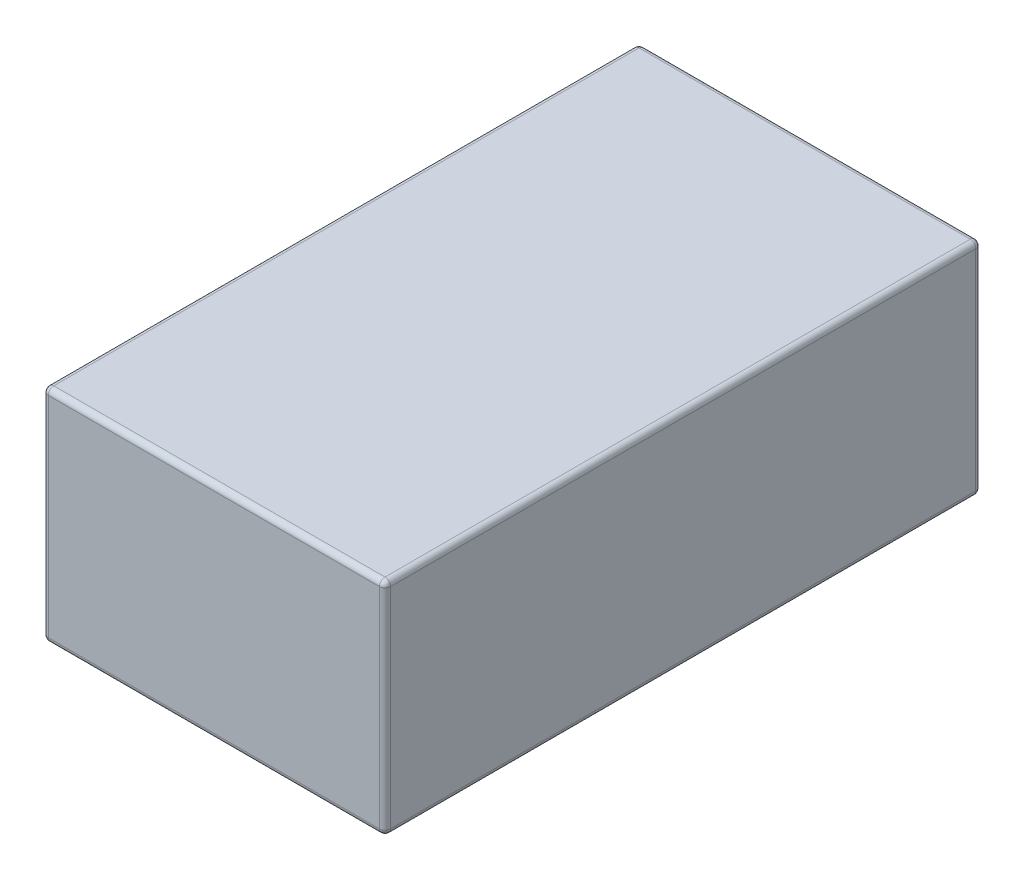
from build123d import *

# Parameters (mm, degrees)
SKETCH_1_W          = 62
SKETCH_1_H          = 108
EXTRUDE_1_DEPTH     = 40
CUT_EXTRUDE_1_DEPTH = 10
FILLET_1_R          = 1


with BuildPart() as part:
    # 草图1 → 凸台-拉伸1 (new body)
    with BuildSketch(Plane(origin=(0, 0, 0), x_dir=(1, 0, 0), z_dir=(0, 1, 0))):
        Rectangle(SKETCH_1_W, SKETCH_1_H)
    extrude(amount=EXTRUDE_1_DEPTH)

    # 草图3 → 切除-拉伸1 (cut)
    # profile 1 of 2: a face of its own
    with BuildSketch(Plane.XZ):
        with BuildLine():
            add(Edge.make_bspline(
                [(2.692365591, 2.665268817), (2.708060657, 2.670496709), (2.744029659, 2.682477677), (2.80834551, 2.690523883), (2.887927636, 2.696251716), (2.983732873, 2.699159867), (3.095176708, 2.692209812), (3.221060717, 2.672013075), (3.360909996, 2.637915008), (3.484604281, 2.600564752), (3.586255639, 2.564755463), (3.659608389, 2.534859596), (3.727296465, 2.501561507), (3.790218923, 2.46639212), (3.847417453, 2.427878502), (3.899532297, 2.387193224), (3.946790581, 2.344282462), (3.999830389, 2.28439533), (4.055731903, 2.210533055), (4.105881323, 2.121784614), (4.137914317, 2.035656741), (4.142240117, 1.978296237), (4.144301075, 1.950967742)],
                knots=[0, 0, 0, 0, 0.553780623, 1.269120991, 2.163729509, 3.232830331, 4.480664985, 5.903029542, 7.503376039, 9.305785439, 10.234765888, 11.117780202, 11.960870582, 12.763595554, 13.533856831, 14.271233816, 14.980009463, 15.671230546, 16.952115016, 18.078508404, 19.084536065, 20, 20, 20, 20], degree=3))
            add(Edge.make_bspline(
                [(4.144301075, 1.950967742), (4.143389416, 1.935084224), (4.141652603, 1.904824359), (4.12963635, 1.861718693), (4.10761855, 1.824815956), (4.08685466, 1.805997545), (4.07655914, 1.796666667)],
                knots=[0, 0, 0, 0, 1.092064677, 2.080504456, 3.048241631, 4, 4, 4, 4], degree=3))
            add(Edge.make_bspline(
                [(4.07655914, 1.796666667), (4.047162709, 1.774192086), (3.990212739, 1.730651881), (3.91184315, 1.661187835), (3.840230968, 1.593644688), (3.785417093, 1.533698618), (3.739407496, 1.479608917), (3.696941707, 1.425849142), (3.644116984, 1.359921622), (3.58236311, 1.280462712), (3.510994627, 1.188220192), (3.430571804, 1.082562813), (3.340146004, 0.964660887), (3.27715558, 0.881434986), (3.244086022, 0.837741935)],
                knots=[0, 0, 0, 0, 1.044716322, 2.023938297, 2.956112171, 3.82364298, 4.316308196, 4.961480688, 5.758265085, 6.70229449, 7.803562713, 9.052159997, 10.452403401, 12, 12, 12, 12], degree=3))
            add(Edge.make_bspline(
                [(3.244086022, 0.837741935), (3.260120237, 0.811028691), (3.288976935, 0.762952997), (3.324565831, 0.697014928), (3.34629993, 0.644095424), (3.354687882, 0.603251711), (3.35203643, 0.572129114), (3.33792162, 0.550280319), (3.315186758, 0.537149104), (3.272687733, 0.53458), (3.208488072, 0.54077049), (3.136376098, 0.554589903), (3.067070901, 0.568263093), (3.002334996, 0.574332256), (2.927498906, 0.577726314), (2.843391635, 0.579679511), (2.751490601, 0.57637421), (2.653899933, 0.563791507), (2.551594536, 0.543455101), (2.482510206, 0.524556016), (2.446989247, 0.51483871)],
                knots=[0, 0, 0, 0, 1.380750272, 2.484929504, 3.319218933, 3.906050837, 4.321227089, 4.666660844, 5.015655865, 5.441854461, 6.523290334, 7.877957796, 8.691536812, 9.653071169, 10.755345, 12.012091177, 13.380969223, 14.826428693, 16.36825088, 18, 18, 18, 18], degree=3))
            add(Edge.make_bspline(
                [(2.446989247, 0.51483871), (2.444043437, 0.485760475), (2.438692827, 0.432944341), (2.437665864, 0.379873763), (2.437204301, 0.356021505)],
                knots=[0, 0, 0, 0, 1.101111799, 2, 2, 2, 2], degree=3))
            add(Edge.make_bspline(
                [(2.437204301, 0.356021505), (2.437889015, 0.329295298), (2.439145893, 0.280235958), (2.455920883, 0.213999686), (2.481514059, 0.160524327), (2.522756653, 0.122080276), (2.577960778, 0.098481742), (2.646825869, 0.08179906), (2.731988204, 0.071926793), (2.794203781, 0.070676272), (2.827849462, 0.07)],
                knots=[0, 0, 0, 0, 1.125302992, 2.065636258, 2.866371255, 3.593285261, 4.38938235, 5.373391023, 6.579551108, 8, 8, 8, 8], degree=3))
            Line((2.827849462, 0.07), (3.395376344, 0.096344086))
            add(Edge.make_bspline(
                [(3.395376344, 0.096344086), (3.421740695, 0.096260922), (3.471538315, 0.096103839), (3.541585967, 0.089551776), (3.603001383, 0.081474109), (3.657055169, 0.067372752), (3.707450666, 0.047903401), (3.754618428, 0.016227211), (3.80149082, -0.024645373), (3.844427581, -0.073906018), (3.882115161, -0.12243821), (3.912023884, -0.164260274), (3.928791691, -0.198022565), (3.93758457, -0.224522354), (3.933647523, -0.245511006), (3.924955225, -0.263377625), (3.909335457, -0.27821385), (3.891569805, -0.288400888), (3.872402266, -0.296032417), (3.85106364, -0.301574249), (3.823850123, -0.30870053), (3.789809762, -0.315032378), (3.749427734, -0.322596246), (3.702740414, -0.330774877), (3.64988142, -0.34006336), (3.52928797, -0.358038344), (3.341651566, -0.380645456), (3.17291798, -0.383796), (3.08827957, -0.385376344)],
                knots=[0, 0, 0, 0, 1.306910492, 2.468523945, 3.487530944, 4.374938771, 5.234601293, 6.152800332, 7.175978169, 8.312796182, 9.385697657, 10.2278885, 10.851232964, 11.261713174, 11.576782984, 11.88287744, 12.234861316, 12.625428626, 12.89349156, 13.255881141, 13.717671377, 14.288764538, 14.972193603, 15.755802524, 16.639625557, 17.634018942, 21.803542446, 26, 26, 26, 26], degree=3))
            add(Edge.make_bspline(
                [(3.08827957, -0.385376344), (3.045856435, -0.384868874), (2.963668343, -0.383885732), (2.844638069, -0.374343223), (2.733802347, -0.361056904), (2.631644002, -0.339336671), (2.537452217, -0.313798403), (2.452132205, -0.281260854), (2.374816352, -0.243644985), (2.306170801, -0.198960423), (2.244546434, -0.148526158), (2.188794415, -0.093423142), (2.138148496, -0.03373808), (2.092708231, 0.030669398), (2.052477267, 0.100027652), (2.019246125, 0.175103239), (1.989090689, 0.253951991), (1.974782785, 0.309191127), (1.967526882, 0.337204301)],
                knots=[0, 0, 0, 0, 1.391550044, 2.69590734, 3.916035752, 5.050968551, 6.119507765, 7.114763045, 8.042467133, 8.935219683, 9.795306254, 10.650969539, 11.503657974, 12.360112807, 13.234110458, 14.129288559, 15.051314528, 16, 16, 16, 16], degree=3))
            add(Edge.make_bspline(
                [(1.967526882, 0.337204301), (1.934807297, 0.326641942), (1.87195378, 0.306351911), (1.779213866, 0.285555784), (1.692712499, 0.272024333), (1.613042784, 0.267756331), (1.542027144, 0.269513825), (1.481305499, 0.277477993), (1.431938911, 0.290314049), (1.394016072, 0.304731212), (1.369042192, 0.331435561), (1.347260589, 0.365211794), (1.321184218, 0.41371286), (1.291444897, 0.477287294), (1.257108951, 0.555460535), (1.217598077, 0.648303883), (1.175136059, 0.756641286), (1.129652024, 0.876712601), (1.084493811, 1.002100189), (1.04436014, 1.126751338), (1.01165452, 1.247509779), (0.983039362, 1.363228234), (0.962370354, 1.475173419), (0.946003552, 1.582517561), (0.936731702, 1.686106652), (0.935461123, 1.753747009), (0.93483871, 1.78688172)],
                knots=[0, 0, 0, 0, 1.149240449, 2.207662655, 3.174745525, 4.073929196, 4.871414988, 5.5489629, 6.112683219, 6.585607399, 6.870387179, 7.317210698, 7.929250324, 8.70987367, 9.664021703, 10.784478502, 12.083908154, 13.554983249, 15.078298145, 16.540372819, 17.932674469, 19.261567318, 20.525375079, 21.7380716, 22.89195818, 24, 24, 24, 24], degree=3))
            add(Edge.make_bspline(
                [(0.93483871, 1.78688172), (0.934414756, 1.82277142), (0.93363137, 1.889088934), (0.927879317, 1.980827705), (0.918358575, 2.057070293), (0.902869521, 2.11812405), (0.886497568, 2.165967426), (0.875778101, 2.204059784), (0.869957108, 2.232975151), (0.865554068, 2.255930876), (0.87144981, 2.280833964), (0.898524847, 2.28541553), (0.927131211, 2.278066979), (0.966120293, 2.261799018), (1.021242812, 2.237886256), (1.089916852, 2.204285487), (1.167370303, 2.160861753), (1.244852385, 2.102034809), (1.321115308, 2.030805075), (1.368598895, 1.976746595), (1.393225806, 1.948709677)],
                knots=[0, 0, 0, 0, 1.714520076, 3.16811535, 4.390379319, 5.37885376, 6.171176299, 6.805129531, 7.270620928, 7.572446211, 7.940156515, 8.327097602, 8.705591225, 9.373430328, 10.328863719, 11.583326282, 13.022566792, 14.564098569, 16.21800236, 18, 18, 18, 18], degree=3))
            add(Edge.make_bspline(
                [(1.393225806, 1.948709677), (1.417211867, 1.988741901), (1.462359029, 2.064091553), (1.535005279, 2.1644402), (1.604124438, 2.247361159), (1.664116049, 2.303602774), (1.71491893, 2.340771747), (1.758022046, 2.367740476), (1.807220583, 2.394973828), (1.862906899, 2.421727095), (1.92483926, 2.449038162), (1.993422704, 2.475601988), (2.067611351, 2.503917787), (2.119742067, 2.520975129), (2.146666667, 2.529784946)],
                knots=[0, 0, 0, 0, 1.707717922, 3.214309404, 4.530362721, 5.654877944, 6.213352942, 6.832574337, 7.515051122, 8.270904371, 9.093461732, 9.992325248, 10.963071218, 12, 12, 12, 12], degree=3))
            add(Edge.make_bspline(
                [(2.146666667, 2.529784946), (2.149857675, 2.557364963), (2.156518971, 2.614938826), (2.163285494, 2.705818283), (2.166565563, 2.804989804), (2.168130795, 2.891575592), (2.167321542, 2.960093161), (2.165326617, 3.005565244), (2.16127213, 3.043941726), (2.157600041, 3.075557944), (2.150919272, 3.100316695), (2.142826786, 3.117626976), (2.133779389, 3.130745724), (2.1250877, 3.132589637), (2.121075269, 3.13344086)],
                knots=[0, 0, 0, 0, 1.613720619, 3.368675535, 5.295099884, 7.380767975, 8.401728707, 9.277841715, 10.025174524, 10.64390704, 11.128690536, 11.500502505, 11.769412006, 12, 12, 12, 12], degree=3))
            add(Edge.make_bspline(
                [(2.121075269, 3.13344086), (2.116790923, 3.132350439), (2.107140885, 3.129894381), (2.097229324, 3.114202715), (2.091468503, 3.09169738), (2.087217518, 3.063365386), (2.082802952, 3.034850712), (2.073772662, 3.010996176), (2.057178156, 2.996170817), (2.044031857, 2.994344532), (2.037526882, 2.99344086)],
                knots=[0, 0, 0, 0, 0.579354927, 1.30493612, 2.334418076, 3.744603853, 5.160889958, 6.238381738, 7.128326168, 8, 8, 8, 8], degree=3))
            add(Edge.make_bspline(
                [(2.037526882, 2.99344086), (2.031022616, 2.994114356), (2.017221789, 2.995543387), (1.999683488, 3.010791421), (1.98292903, 3.031050869), (1.969100929, 3.06061771), (1.954662382, 3.096781894), (1.943357952, 3.141985494), (1.931761075, 3.194599123), (1.92612693, 3.232747129), (1.92311828, 3.25311828)],
                knots=[0, 0, 0, 0, 0.512685013, 1.087821071, 1.788185926, 2.624591649, 3.681423227, 4.910716466, 6.350313288, 8, 8, 8, 8], degree=3))
            add(Edge.make_bspline(
                [(1.92311828, 3.25311828), (1.913786574, 3.275836732), (1.896433654, 3.31808319), (1.876642166, 3.378402646), (1.863980288, 3.4302088), (1.859002413, 3.474645721), (1.86402431, 3.51389476), (1.884155358, 3.546832876), (1.915633064, 3.573889683), (1.972423658, 3.598187155), (2.046267747, 3.622040083), (2.107830981, 3.626060036), (2.13688172, 3.627956989)],
                knots=[0, 0, 0, 0, 1.275020111, 2.370983895, 3.293819499, 4.039309166, 4.686169846, 5.305137666, 5.997624495, 6.807609614, 8.493560299, 10, 10, 10, 10], degree=3))
            add(Edge.make_bspline(
                [(2.13688172, 3.627956989), (2.162403093, 3.626877652), (2.211407252, 3.624805192), (2.280602636, 3.60256147), (2.341674795, 3.567030212), (2.41014842, 3.495928218), (2.490086261, 3.38990634), (2.578263269, 3.280023622), (2.641400307, 3.174163702), (2.674941064, 3.077387045), (2.69405108, 2.966853988), (2.696397455, 2.888647812), (2.697634409, 2.847419355)],
                knots=[0, 0, 0, 0, 0.731505247, 1.404579586, 2.067722297, 2.741144488, 4.223818725, 5.888825166, 6.787197857, 7.75239781, 8.815116991, 10, 10, 10, 10], degree=3))
            add(Edge.make_bspline(
                [(2.697634409, 2.847419355), (2.697250987, 2.820068374), (2.696399468, 2.759326223), (2.693796497, 2.698633058), (2.692365591, 2.665268817)],
                knots=[0, 0, 0, 0, 0.900560175, 2, 2, 2, 2], degree=3))
        make_face()
        with BuildLine():
            add(Edge.make_bspline(
                [(2.852688172, 1.048494624), (2.879674384, 1.088796786), (2.931907457, 1.166803502), (3.005510645, 1.281651686), (3.07403453, 1.389266955), (3.137285768, 1.489557279), (3.194005194, 1.583549887), (3.244948981, 1.670363779), (3.290363717, 1.750271788), (3.329843777, 1.823521677), (3.363350421, 1.890954102), (3.39422299, 1.951586438), (3.418626649, 2.007737403), (3.440325228, 2.057751089), (3.455938326, 2.102913662), (3.467598901, 2.142271648), (3.474793774, 2.176001491), (3.477551884, 2.212118759), (3.475885767, 2.249167127), (3.471628657, 2.285975481), (3.465777989, 2.314042991), (3.454925699, 2.335180435), (3.434991068, 2.347348135), (3.408460223, 2.355004018), (3.372968167, 2.36002817), (3.346218273, 2.360286811), (3.331397849, 2.360430108)],
                knots=[0, 0, 0, 0, 2.207533216, 4.272783509, 6.208374139, 8.01438313, 9.669259998, 11.204742639, 12.595668911, 13.852484494, 14.991343408, 16.022957787, 16.948216244, 17.777445438, 18.503367713, 19.121391775, 19.645444377, 20.069351102, 20.766312679, 21.330045685, 21.75379857, 22.071087082, 22.37515375, 22.783229838, 23.325864668, 24, 24, 24, 24], degree=3))
            add(Edge.make_bspline(
                [(3.331397849, 2.360430108), (3.265381535, 2.359390004), (3.138955101, 2.357398124), (2.957194015, 2.343167959), (2.791597592, 2.319760751), (2.68817938, 2.293774321), (2.638924731, 2.281397849)],
                knots=[0, 0, 0, 0, 1.133283853, 2.170327684, 3.128588029, 4, 4, 4, 4], degree=3))
            add(Edge.make_bspline(
                [(2.638924731, 2.281397849), (2.635192556, 2.26387348), (2.626972393, 2.225275839), (2.618702284, 2.160818579), (2.610120093, 2.084831945), (2.606331583, 2.030021579), (2.604301075, 2.000645161)],
                knots=[0, 0, 0, 0, 0.759081118, 1.671885585, 2.752213022, 4, 4, 4, 4], degree=3))
            add(Edge.make_bspline(
                [(2.604301075, 2.000645161), (2.619548294, 2.003907696), (2.649818849, 2.010384861), (2.680768607, 2.010918132), (2.696129032, 2.011182796)],
                knots=[0, 0, 0, 0, 1.007396073, 2, 2, 2, 2], degree=3))
            add(Edge.make_bspline(
                [(2.696129032, 2.011182796), (2.709937361, 2.01043611), (2.737251006, 2.008959125), (2.777334741, 2.002340504), (2.813903512, 1.986667684), (2.849210135, 1.968614), (2.880475335, 1.942535738), (2.911708709, 1.913748237), (2.937114143, 1.876556305), (2.968705556, 1.824968588), (2.999623962, 1.763683596), (3.02989955, 1.701581038), (3.047502333, 1.65613672), (3.057411572, 1.623907641), (3.051706572, 1.60008017), (3.038388423, 1.581216176), (3.015442134, 1.566929035), (2.974915278, 1.550897387), (2.918942768, 1.528068979), (2.864882139, 1.492146089), (2.818956791, 1.454214498), (2.777838996, 1.413605696), (2.72890465, 1.362398748), (2.694497018, 1.32384565), (2.675806452, 1.302903226)],
                knots=[0, 0, 0, 0, 0.847625029, 1.676649638, 2.470144591, 3.274874384, 4.095880605, 4.954582549, 5.867688959, 6.840429065, 8.662367611, 10.071960045, 11.059644011, 11.671585918, 12.081729159, 12.512385048, 13.053863842, 13.707799244, 15.187310502, 16.743482136, 17.660590303, 18.834619167, 20.280533823, 22, 22, 22, 22], degree=3))
            add(Edge.make_bspline(
                [(2.675806452, 1.302903226), (2.679549631, 1.279669704), (2.68719227, 1.232232656), (2.724399508, 1.165327369), (2.77959749, 1.102164883), (2.827285214, 1.067147936), (2.852688172, 1.048494624)],
                knots=[0, 0, 0, 0, 0.876164182, 1.78890846, 2.82216513, 4, 4, 4, 4], degree=3))
        make_face(mode=Mode.SUBTRACT)
        with BuildLine():
            add(Edge.make_bspline(
                [(2.084193548, 2.12483871), (2.037002093, 2.107205131), (1.94733077, 2.073698506), (1.824097838, 2.015578661), (1.720193748, 1.95231814), (1.634499052, 1.885958035), (1.566435147, 1.816070068), (1.518800556, 1.740676616), (1.487592836, 1.66153611), (1.484389262, 1.60651106), (1.482795699, 1.579139785)],
                knots=[0, 0, 0, 0, 1.400088342, 2.660392117, 3.78120692, 4.774627862, 5.667610289, 6.476412897, 7.242117524, 8, 8, 8, 8], degree=3))
            add(Edge.make_bspline(
                [(1.482795699, 1.579139785), (1.483144794, 1.568339592), (1.483877197, 1.545680744), (1.486625942, 1.523175903), (1.488064516, 1.511397849)],
                knots=[0, 0, 0, 0, 0.953287084, 2, 2, 2, 2], degree=3))
            add(Edge.make_bspline(
                [(1.488064516, 1.511397849), (1.501824174, 1.519496258), (1.531651122, 1.53705126), (1.580865855, 1.563892456), (1.637415629, 1.595032547), (1.702054644, 1.629365482), (1.774456114, 1.667954775), (1.854674472, 1.709992761), (1.942941014, 1.755014407), (2.004162489, 1.78637069), (2.036021505, 1.802688172)],
                knots=[0, 0, 0, 0, 0.617357482, 1.338251963, 2.16753477, 3.113769204, 4.168438846, 5.340137805, 6.615835481, 8, 8, 8, 8], degree=3))
            add(Edge.make_bspline(
                [(2.036021505, 1.802688172), (2.039264587, 1.826274848), (2.045373737, 1.870706203), (2.054215395, 1.932959083), (2.062804757, 1.986566835), (2.069350066, 2.03125923), (2.074877561, 2.067104033), (2.078438413, 2.094007043), (2.081183516, 2.112394091), (2.083406342, 2.121584099), (2.084193548, 2.12483871)],
                knots=[0, 0, 0, 0, 1.754009283, 3.304111501, 4.632114419, 5.753546401, 6.631864835, 7.30366706, 7.753396049, 8, 8, 8, 8], degree=3))
        make_face(mode=Mode.SUBTRACT)
        with BuildLine():
            add(Edge.make_bspline(
                [(1.561075269, 0.973225806), (1.587975147, 0.991967228), (1.638471509, 1.027148563), (1.708181043, 1.077389864), (1.767287491, 1.121143212), (1.815575129, 1.158607014), (1.853264704, 1.19012975), (1.880358915, 1.214697686), (1.898214712, 1.232755435), (1.902728174, 1.244586616), (1.904301075, 1.248709677)],
                knots=[0, 0, 0, 0, 1.777925732, 3.337516321, 4.660077953, 5.765139076, 6.653633231, 7.318125862, 7.762372939, 8, 8, 8, 8], degree=3))
            add(Edge.make_bspline(
                [(1.904301075, 1.248709677), (1.9016913, 1.253951664), (1.894552319, 1.268290998), (1.878411997, 1.271968161), (1.868172043, 1.274301075)],
                knots=[0, 0, 0, 0, 0.731133853, 2, 2, 2, 2], degree=3))
            add(Edge.make_bspline(
                [(1.868172043, 1.274301075), (1.838640915, 1.284907284), (1.7777091, 1.306791161), (1.68626287, 1.349516981), (1.590130382, 1.398434827), (1.526230699, 1.436734076), (1.493333333, 1.456451613)],
                knots=[0, 0, 0, 0, 0.901316192, 1.859692951, 2.898109345, 4, 4, 4, 4], degree=3))
            add(Edge.make_bspline(
                [(1.493333333, 1.456451613), (1.494260637, 1.417025375), (1.49613172, 1.337472373), (1.509695349, 1.217323972), (1.530311177, 1.095292148), (1.550735281, 1.014253003), (1.561075269, 0.973225806)],
                knots=[0, 0, 0, 0, 0.966864773, 1.950908814, 2.96261901, 4, 4, 4, 4], degree=3))
        make_face(mode=Mode.SUBTRACT)
        with BuildLine():
            add(Edge.make_bspline(
                [(2.715698925, 1.004086022), (2.707783939, 1.032499147), (2.693172093, 1.084952589), (2.660782388, 1.152927996), (2.620497363, 1.204211627), (2.586433006, 1.223732586), (2.570430108, 1.232903226)],
                knots=[0, 0, 0, 0, 1.262082697, 2.329929597, 3.21542721, 4, 4, 4, 4], degree=3))
            add(Edge.make_bspline(
                [(2.570430108, 1.232903226), (2.554697059, 1.216959944), (2.526220693, 1.188103063), (2.493344727, 1.144148077), (2.471689636, 1.105545355), (2.463293969, 1.062625158), (2.467410781, 1.018890178), (2.480937296, 0.990304381), (2.48688172, 0.977741935)],
                knots=[0, 0, 0, 0, 1.374911662, 2.488550525, 3.371505862, 4.064219064, 5.149292777, 6, 6, 6, 6], degree=3))
            add(Edge.make_bspline(
                [(2.48688172, 0.977741935), (2.526050956, 0.981501186), (2.602490202, 0.98883741), (2.678592972, 0.999088047), (2.715698925, 1.004086022)],
                knots=[0, 0, 0, 0, 1.024846197, 2, 2, 2, 2], degree=3))
        make_face(mode=Mode.SUBTRACT)
    # profile 2 of 2: a face of its own
    with BuildSketch(Plane.XZ):
        with BuildLine():
            add(Edge.make_bspline(
                [(9.599032258, 1.29311828), (9.592444893, 1.264781631), (9.579750957, 1.210176543), (9.562460521, 1.131132997), (9.547398399, 1.058671381), (9.534918603, 0.99248264), (9.526254866, 0.932653575), (9.51901223, 0.879023155), (9.51523576, 0.831773789), (9.514375167, 0.802370173), (9.513978495, 0.788817204)],
                knots=[0, 0, 0, 0, 1.362865652, 2.626259694, 3.790345544, 4.830061757, 5.780872956, 6.622059719, 7.364867891, 8, 8, 8, 8], degree=3))
            add(Edge.make_bspline(
                [(9.513978495, 0.788817204), (9.514255523, 0.773225098), (9.514791634, 0.743050885), (9.523257102, 0.700202197), (9.536518572, 0.661926709), (9.550511936, 0.631252949), (9.571830295, 0.610219299), (9.597361071, 0.595597607), (9.63271294, 0.582767268), (9.677115717, 0.56913837), (9.731251138, 0.556743777), (9.795088493, 0.544895863), (9.86827657, 0.532642532), (9.978746631, 0.519306688), (10.121914642, 0.504169446), (10.294141022, 0.491749593), (10.464021933, 0.482948252), (10.63099099, 0.480536933), (10.794615819, 0.485126513), (10.953026904, 0.500122172), (11.106288267, 0.52477659), (11.251153365, 0.559845204), (11.38300313, 0.600588077), (11.497912244, 0.64207904), (11.592400745, 0.685966662), (11.668933135, 0.732200822), (11.728952278, 0.783944801), (11.77767772, 0.839264675), (11.814584078, 0.901203132), (11.841481079, 0.969677437), (11.859703354, 1.048100326), (11.873887141, 1.138394999), (11.882232961, 1.242558043), (11.884990386, 1.316439695), (11.886451613, 1.355591398)],
                knots=[0, 0, 0, 0, 0.49319545, 0.954443461, 1.374051513, 1.77927045, 2.00400226, 2.310598557, 2.703075791, 3.193189541, 3.780993194, 4.460412132, 5.249377634, 6.130429517, 7.983615499, 9.808134717, 11.598000493, 13.370000485, 15.095064169, 16.779072611, 18.405333761, 20.006794307, 21.494656371, 22.77427168, 23.872529852, 24.789706873, 25.595496559, 26.372854254, 27.114128646, 27.866602768, 28.693313485, 29.658647138, 30.759259563, 32, 32, 32, 32], degree=3))
            add(Edge.make_bspline(
                [(11.886451613, 1.355591398), (11.886485147, 1.370955064), (11.886542535, 1.397247905), (11.891813067, 1.429811685), (11.895392746, 1.451866582), (11.911502194, 1.464226412), (11.929811327, 1.445104046), (11.945836782, 1.416241548), (11.970634495, 1.366168699), (11.986465293, 1.32651525), (11.995591398, 1.303655914)],
                knots=[0, 0, 0, 0, 1.25511351, 2.147957425, 2.713763759, 3.0560266, 3.529458808, 4.482111776, 5.972015316, 8, 8, 8, 8], degree=3))
            Line((11.995591398, 1.303655914), (12.161935484, 0.892688172))
            add(Edge.make_bspline(
                [(12.161935484, 0.892688172), (12.170038886, 0.872395057), (12.18559106, 0.833448197), (12.206753896, 0.777011072), (12.224477082, 0.725448996), (12.240206585, 0.679059099), (12.25156413, 0.637320779), (12.258716898, 0.599992265), (12.264889595, 0.567975498), (12.265520676, 0.547979597), (12.265806452, 0.538924731)],
                knots=[0, 0, 0, 0, 1.416118151, 2.717835919, 3.905709705, 4.949523432, 5.89218533, 6.705350077, 7.413735803, 8, 8, 8, 8], degree=3))
            add(Edge.make_bspline(
                [(12.265806452, 0.538924731), (12.264383322, 0.524764139), (12.261405812, 0.495136965), (12.233537415, 0.454907472), (12.193180059, 0.416682092), (12.136264211, 0.381518524), (12.065014289, 0.346854343), (11.97752113, 0.315057683), (11.874609525, 0.28469397), (11.714725408, 0.245411204), (11.497394018, 0.204093125), (11.222252012, 0.170764365), (10.9324361, 0.147630828), (10.734134345, 0.14557174), (10.632473118, 0.144516129)],
                knots=[0, 0, 0, 0, 0.289291107, 0.605262688, 0.978580504, 1.435037502, 1.976610234, 2.611976756, 3.352019369, 4.189186046, 6.006936304, 7.910751384, 9.903608926, 12, 12, 12, 12], degree=3))
            add(Edge.make_bspline(
                [(10.632473118, 0.144516129), (10.5745066, 0.14486217), (10.460529551, 0.145542575), (10.292369339, 0.153512822), (10.129951525, 0.165287245), (9.976103281, 0.181632011), (9.836754419, 0.200504962), (9.717132273, 0.2212151), (9.620296037, 0.243260091), (9.542655954, 0.26648687), (9.479025589, 0.295781906), (9.42441185, 0.333203064), (9.373530505, 0.377209984), (9.328812274, 0.430898019), (9.289032729, 0.49454705), (9.255827044, 0.569503872), (9.227221121, 0.655445933), (9.203900711, 0.75283076), (9.18792964, 0.862670584), (9.177773082, 0.984568424), (9.173062913, 1.119230551), (9.175498214, 1.213083596), (9.176774194, 1.262258065)],
                knots=[0, 0, 0, 0, 1.55936067, 3.066103248, 4.528078258, 5.939890933, 7.227638593, 8.310741509, 9.204716047, 9.898513539, 10.487344047, 11.080798949, 11.673869863, 12.291809275, 12.952921514, 13.686956757, 14.491669453, 15.387197069, 16.377135272, 17.474696357, 18.676862699, 20, 20, 20, 20], degree=3))
            add(Edge.make_bspline(
                [(9.176774194, 1.262258065), (9.158663281, 1.27260445), (9.117415188, 1.296168623), (9.05585731, 1.347343118), (8.985566855, 1.414833272), (8.938296389, 1.467624808), (8.912580645, 1.496344086)],
                knots=[0, 0, 0, 0, 0.704415322, 1.604324979, 2.696721824, 4, 4, 4, 4], degree=3))
            add(Edge.make_bspline(
                [(8.912580645, 1.496344086), (8.896772306, 1.486414936), (8.865714876, 1.466907899), (8.823952403, 1.431800526), (8.787323729, 1.392664247), (8.758168807, 1.349344649), (8.734603947, 1.30659406), (8.716472875, 1.266586152), (8.706297311, 1.2293794), (8.704275836, 1.205602152), (8.703333333, 1.194516129)],
                knots=[0, 0, 0, 0, 1.174603543, 2.307653262, 3.425950689, 4.539324629, 5.586112002, 6.49910686, 7.300216074, 8, 8, 8, 8], degree=3))
            add(Edge.make_bspline(
                [(8.703333333, 1.194516129), (8.704589877, 1.18653747), (8.707582502, 1.16753523), (8.726550658, 1.141822689), (8.744169591, 1.110189343), (8.747894666, 1.072618553), (8.746207924, 1.036157473), (8.739640235, 1.013047757), (8.736451613, 1.001827957)],
                knots=[0, 0, 0, 0, 0.706764248, 1.68325335, 2.777264048, 3.878034917, 4.969782923, 6, 6, 6, 6], degree=3))
            add(Edge.make_bspline(
                [(8.736451613, 1.001827957), (8.727322197, 0.966783386), (8.707547647, 0.890875946), (8.683463216, 0.76613522), (8.660393977, 0.622777151), (8.639610988, 0.467134163), (8.622177758, 0.31277574), (8.609626441, 0.172471383), (8.600064092, 0.053069561), (8.599130784, -0.019806604), (8.598709677, -0.052688172)],
                knots=[0, 0, 0, 0, 0.815560283, 1.766524503, 2.860085677, 4.086161159, 5.303163677, 6.358723682, 7.259459678, 8, 8, 8, 8], degree=3))
            Line((8.598709677, -0.052688172), (8.598709677, -0.136236559))
            add(Edge.make_bspline(
                [(8.598709677, -0.136236559), (8.597593427, -0.152955874), (8.595570242, -0.18325937), (8.576559097, -0.224392936), (8.5386334, -0.24706603), (8.510165471, -0.249392578), (8.49483871, -0.250645161)],
                knots=[0, 0, 0, 0, 1.140048042, 2.066319164, 2.958931513, 4, 4, 4, 4], degree=3))
            add(Edge.make_bspline(
                [(8.49483871, -0.250645161), (8.487252776, -0.249928154), (8.470155484, -0.248312151), (8.443125921, -0.2383277), (8.412201838, -0.223097666), (8.377500672, -0.201471924), (8.338495536, -0.174450573), (8.295624627, -0.141177405), (8.249052075, -0.101588318), (8.198603878, -0.058019284), (8.149205334, -0.008598826), (8.10566033, 0.046669224), (8.06729369, 0.105895404), (8.036129445, 0.17001985), (8.009927252, 0.238114794), (7.99192708, 0.310785284), (7.977414351, 0.38736921), (7.974150023, 0.440252764), (7.972473118, 0.467419355)],
                knots=[0, 0, 0, 0, 0.385651768, 0.869187792, 1.450465448, 2.13665893, 2.942552304, 3.860085888, 4.891188589, 6.046739649, 7.245125045, 8.433168782, 9.613740687, 10.821841786, 12.047753691, 13.311812283, 14.619062256, 16, 16, 16, 16], degree=3))
            add(Edge.make_bspline(
                [(7.972473118, 0.467419355), (7.969446965, 0.524388157), (7.963511589, 0.636124506), (7.950770322, 0.800387536), (7.938680967, 0.958313038), (7.92333056, 1.10957474), (7.906852621, 1.254365675), (7.888844405, 1.392635342), (7.869414236, 1.52465407), (7.854715266, 1.610277336), (7.847526882, 1.652150538)],
                knots=[0, 0, 0, 0, 1.148557263, 2.252734663, 3.317008686, 4.337363422, 5.313587368, 6.250926841, 7.144633281, 8, 8, 8, 8], degree=3))
            add(Edge.make_bspline(
                [(7.847526882, 1.652150538), (7.84139497, 1.690706584), (7.830126804, 1.761558207), (7.827602322, 1.833239996), (7.826451613, 1.865913978)],
                knots=[0, 0, 0, 0, 1.088360297, 2, 2, 2, 2], degree=3))
            add(Edge.make_bspline(
                [(7.826451613, 1.865913978), (7.827839154, 1.895726906), (7.830433704, 1.951473835), (7.854696286, 2.027982208), (7.896288308, 2.090883079), (7.936488837, 2.117500265), (7.956666667, 2.130860215)],
                knots=[0, 0, 0, 0, 1.150387354, 2.151099105, 3.07198216, 4, 4, 4, 4], degree=3))
            add(Edge.make_bspline(
                [(7.956666667, 2.130860215), (7.990945709, 2.148630782), (8.055979394, 2.182344834), (8.1455512, 2.234512774), (8.22144208, 2.285915714), (8.284029462, 2.335013828), (8.332728382, 2.38147468), (8.36870622, 2.421724208), (8.392681653, 2.456779784), (8.396785397, 2.480156128), (8.398494624, 2.489892473)],
                knots=[0, 0, 0, 0, 1.590331395, 3.017152827, 4.266922186, 5.362836283, 6.29117538, 7.031025449, 7.596418077, 8, 8, 8, 8], degree=3))
            add(Edge.make_bspline(
                [(8.398494624, 2.489892473), (8.397005034, 2.496513072), (8.393188631, 2.513475377), (8.376522736, 2.541128511), (8.349467076, 2.575389271), (8.298983122, 2.633671208), (8.230953211, 2.721438128), (8.17250722, 2.821311776), (8.130957874, 2.901645358), (8.108874898, 2.954086621), (8.094504191, 2.995726009), (8.088826919, 3.028106576), (8.090908936, 3.053169455), (8.102130935, 3.071014904), (8.120344519, 3.082319895), (8.134611178, 3.082763148), (8.142580645, 3.083010753)],
                knots=[0, 0, 0, 0, 0.397238112, 1.017743879, 1.870490768, 2.969865479, 5.548781873, 8.387585192, 9.759936364, 10.864150896, 11.731951514, 12.343269331, 12.78977774, 13.174490298, 13.53886383, 14, 14, 14, 14], degree=3))
            add(Edge.make_bspline(
                [(8.142580645, 3.083010753), (8.148862197, 3.082598241), (8.163255774, 3.081653009), (8.187671336, 3.077623794), (8.217451175, 3.070638353), (8.253046226, 3.061455185), (8.294333457, 3.050376213), (8.340991566, 3.035965634), (8.392978239, 3.018286142), (8.468817024, 2.993073712), (8.56344477, 2.958260126), (8.669277337, 2.908643266), (8.765293489, 2.854242471), (8.850030513, 2.795056968), (8.922340747, 2.729776731), (8.973066896, 2.65317907), (9.005361294, 2.568882955), (9.008723393, 2.509499751), (9.010430108, 2.479354839)],
                knots=[0, 0, 0, 0, 0.265837946, 0.609142366, 1.043728141, 1.557893263, 2.16216646, 2.849511258, 3.620449317, 4.481895322, 6.226174435, 7.876353532, 9.414581961, 10.882126798, 12.239254982, 13.500435537, 14.731136965, 16, 16, 16, 16], degree=3))
            add(Edge.make_bspline(
                [(9.010430108, 2.479354839), (9.010332342, 2.462768629), (9.010146419, 2.431226538), (9.003599595, 2.386455144), (8.994966916, 2.346242741), (8.982589834, 2.310842373), (8.966375082, 2.281887206), (8.950469866, 2.257065226), (8.930133787, 2.240701175), (8.908719921, 2.228150045), (8.883229929, 2.221950716), (8.853507155, 2.217658433), (8.818049425, 2.214458274), (8.762723399, 2.214801616), (8.687585236, 2.210228085), (8.613564713, 2.191328448), (8.557743531, 2.17284518), (8.521191627, 2.165563459), (8.492358537, 2.15816806), (8.475047483, 2.157490319), (8.467741935, 2.157204301)],
                knots=[0, 0, 0, 0, 1.221058734, 2.322094507, 3.326999567, 4.25124971, 5.07036081, 5.773315339, 6.403143833, 6.974316606, 7.589032509, 8.318721201, 9.191006026, 10.208256197, 12.396697316, 14.715632643, 15.81558082, 16.726225974, 17.462446537, 18, 18, 18, 18], degree=3))
            add(Edge.make_bspline(
                [(8.467741935, 2.157204301), (8.45032999, 2.157936081), (8.417890814, 2.159299418), (8.373198132, 2.172706671), (8.337352626, 2.196804127), (8.321381702, 2.219119642), (8.31344086, 2.230215054)],
                knots=[0, 0, 0, 0, 1.165429263, 2.171243011, 3.09073079, 4, 4, 4, 4], degree=3))
            add(Edge.make_bspline(
                [(8.31344086, 2.230215054), (8.288587937, 2.221819296), (8.237647318, 2.204610651), (8.178567354, 2.173294277), (8.136139689, 2.144662741), (8.113723247, 2.121535018), (8.098051052, 2.098438152), (8.09609107, 2.081629585), (8.09516129, 2.073655914)],
                knots=[0, 0, 0, 0, 1.67539269, 3.434024283, 4.26229151, 4.931871941, 5.493299951, 6, 6, 6, 6], degree=3))
            add(Edge.make_bspline(
                [(8.09516129, 2.073655914), (8.095716283, 2.066098312), (8.097008053, 2.048507652), (8.104660985, 2.019472132), (8.115115046, 1.983730021), (8.130496404, 1.941624904), (8.150114118, 1.892700957), (8.174294614, 1.837384255), (8.202158345, 1.775296819), (8.222771488, 1.732142013), (8.233655914, 1.709354839)],
                knots=[0, 0, 0, 0, 0.463913197, 1.07977893, 1.834371154, 2.749349705, 3.826551669, 5.067093644, 6.451327781, 8, 8, 8, 8], degree=3))
            add(Edge.make_bspline(
                [(8.233655914, 1.709354839), (8.239202611, 1.695656143), (8.250599749, 1.667508591), (8.26287943, 1.621645209), (8.269156994, 1.571045809), (8.271931204, 1.495039738), (8.265068491, 1.38896187), (8.248037022, 1.302987714), (8.238924731, 1.256989247)],
                knots=[0, 0, 0, 0, 0.578409517, 1.188493556, 1.85266355, 2.570475089, 4.165112724, 6, 6, 6, 6], degree=3))
            add(Edge.make_bspline(
                [(8.238924731, 1.256989247), (8.229330391, 1.2138485), (8.211104355, 1.131895512), (8.18603304, 1.014769181), (8.165001181, 0.909627464), (8.14751396, 0.816310389), (8.134080596, 0.735244445), (8.123567868, 0.666332224), (8.118499387, 0.609247266), (8.115276834, 0.55100765), (8.116734715, 0.490842431), (8.122792447, 0.428288362), (8.131157802, 0.375188061), (8.143608941, 0.332097235), (8.159175996, 0.298135542), (8.178973871, 0.274026955), (8.2017633, 0.258143245), (8.22409629, 0.253784719), (8.243449534, 0.257481768), (8.258809728, 0.26877835), (8.275085517, 0.285385963), (8.292196049, 0.308535403), (8.311385824, 0.337470969), (8.331066532, 0.373540575), (8.353002762, 0.415524181), (8.375777339, 0.464169397), (8.398754012, 0.519801328), (8.423140632, 0.582353185), (8.446882384, 0.652597635), (8.471708118, 0.730137862), (8.497389932, 0.815110781), (8.522768772, 0.907520987), (8.548326403, 1.007210187), (8.565158708, 1.076076041), (8.573870968, 1.11172043)],
                knots=[0, 0, 0, 0, 2.120575173, 4.028383439, 5.747168169, 7.265419316, 8.583524743, 9.690161614, 10.608969567, 11.332189225, 12.488147722, 13.491984022, 14.346980489, 15.063050845, 15.639146398, 16.126227321, 16.543604804, 16.947392463, 17.181140223, 17.468306154, 17.842860171, 18.297945564, 18.845537478, 19.50853665, 20.267733814, 21.118652373, 22.084522058, 23.155418225, 24.339433691, 25.641498465, 27.062106881, 28.598387892, 30.239354093, 32, 32, 32, 32], degree=3))
            add(Edge.make_bspline(
                [(8.573870968, 1.11172043), (8.583108563, 1.143242259), (8.601741626, 1.206824633), (8.649537194, 1.295865602), (8.709083629, 1.381126064), (8.78137253, 1.45710333), (8.855845051, 1.521930962), (8.925447167, 1.570792214), (8.988237413, 1.603349661), (9.029478117, 1.608452801), (9.048064516, 1.610752688)],
                knots=[0, 0, 0, 0, 1.09100456, 2.2006547, 3.345589724, 4.545404839, 5.682542258, 6.625614931, 7.380590861, 8, 8, 8, 8], degree=3))
            Line((9.048064516, 1.610752688), (9.106774194, 1.605483871))
            add(Edge.make_bspline(
                [(9.106774194, 1.605483871), (9.123366698, 1.60730807), (9.158998064, 1.611225424), (9.190696841, 1.628087098), (9.207634409, 1.637096774)],
                knots=[0, 0, 0, 0, 0.931342558, 2, 2, 2, 2], degree=3))
            add(Edge.make_bspline(
                [(9.207634409, 1.637096774), (9.213162976, 1.657860764), (9.223301271, 1.6959378), (9.233629572, 1.749086619), (9.24081929, 1.792202023), (9.243738197, 1.826504509), (9.242009766, 1.852886543), (9.235771299, 1.872971721), (9.223379075, 1.88701247), (9.200520907, 1.893172095), (9.169929564, 1.902247536), (9.139491383, 1.933367639), (9.118782336, 1.976985088), (9.112360744, 2.021344473), (9.117175633, 2.060994928), (9.133776739, 2.091180589), (9.15808385, 2.121555767), (9.191288792, 2.150376785), (9.230937833, 2.176580552), (9.275889666, 2.195330622), (9.324195706, 2.207168117), (9.35759938, 2.208471379), (9.374731183, 2.209139785)],
                knots=[0, 0, 0, 0, 1.615449756, 2.962414342, 4.069894823, 4.902044158, 5.546071686, 6.047424917, 6.461247327, 6.885268123, 7.792928015, 8.833959325, 10.032231787, 11.385130457, 12.148321241, 12.992154164, 13.932185554, 15.068230394, 16.28244117, 17.491509764, 18.713466081, 20, 20, 20, 20], degree=3))
            add(Edge.make_bspline(
                [(9.374731183, 2.209139785), (9.39213465, 2.208308917), (9.426243717, 2.206680499), (9.474981035, 2.192818248), (9.519313966, 2.169772032), (9.557773335, 2.136446326), (9.592396246, 2.094939215), (9.621324806, 2.044091972), (9.645548834, 1.984224117), (9.657456883, 1.940830776), (9.663763441, 1.917849462)],
                knots=[0, 0, 0, 0, 0.932939612, 1.828468931, 2.696110581, 3.594673887, 4.541512806, 5.585766236, 6.721410688, 8, 8, 8, 8], degree=3))
            add(Edge.make_bspline(
                [(9.663763441, 1.917849462), (9.706019819, 1.942890581), (9.790982615, 1.99323951), (9.871618856, 2.05026231), (9.912150538, 2.078924731)],
                knots=[0, 0, 0, 0, 0.994703104, 2, 2, 2, 2], degree=3))
            add(Edge.make_bspline(
                [(9.912150538, 2.078924731), (9.914895064, 2.104768648), (9.920144193, 2.15419725), (9.927923333, 2.225149309), (9.93401531, 2.28988302), (9.93831579, 2.348131586), (9.942098083, 2.399812796), (9.945463286, 2.444944521), (9.94669557, 2.483869287), (9.948030601, 2.524758345), (9.94646224, 2.565253558), (9.941088148, 2.602612137), (9.93021359, 2.628231991), (9.911201586, 2.638129413), (9.894628723, 2.633322198), (9.881539716, 2.622277208), (9.875457944, 2.603214732), (9.874433529, 2.581275431), (9.87392622, 2.559359422), (9.870010007, 2.542012126), (9.862894365, 2.529651886), (9.850005811, 2.525084491), (9.834557057, 2.532017246), (9.817891589, 2.547588072), (9.795853612, 2.571031146), (9.77180207, 2.60267019), (9.747907869, 2.639470936), (9.730118494, 2.680597264), (9.720886194, 2.724039082), (9.716491329, 2.768135098), (9.720813228, 2.811758264), (9.734246469, 2.852914478), (9.758845324, 2.888799261), (9.790757459, 2.920761568), (9.831176473, 2.947575775), (9.879838667, 2.965714234), (9.935435956, 2.977420382), (9.974806867, 2.9785437), (9.995698925, 2.979139785)],
                knots=[0, 0, 0, 0, 2.019565566, 3.862583988, 5.546527465, 7.071752087, 8.401097585, 9.57348813, 10.588059087, 11.426638045, 12.753694034, 13.72500655, 14.370752082, 14.824230611, 15.2451036, 15.63209936, 16.113628988, 16.740254766, 17.34590481, 17.809332864, 18.117600619, 18.407437891, 18.777359198, 19.358997636, 20.186626235, 21.27074744, 22.444596081, 23.588929838, 24.728770447, 25.883191005, 27.020026316, 28.111311588, 29.209021858, 30.367058721, 31.605359207, 32.944959076, 34.378851556, 36, 36, 36, 36], degree=3))
            add(Edge.make_bspline(
                [(9.995698925, 2.979139785), (10.029668942, 2.978165264), (10.093640025, 2.976330081), (10.182844793, 2.958151742), (10.25930187, 2.929336526), (10.322323157, 2.887144349), (10.371326714, 2.831977152), (10.405518802, 2.764345215), (10.425922249, 2.685257278), (10.428100644, 2.628767485), (10.429247312, 2.599032258)],
                knots=[0, 0, 0, 0, 1.234083311, 2.323980136, 3.294961903, 4.188407703, 5.054595169, 5.948413704, 6.920081314, 8, 8, 8, 8], degree=3))
            add(Edge.make_bspline(
                [(10.429247312, 2.599032258), (10.428518179, 2.571388207), (10.426954588, 2.512106832), (10.418143283, 2.45345297), (10.41344086, 2.422150538)],
                knots=[0, 0, 0, 0, 0.932638666, 2, 2, 2, 2], degree=3))
            add(Edge.make_bspline(
                [(10.41344086, 2.422150538), (10.430040685, 2.439425557), (10.461905178, 2.472586129), (10.510808791, 2.516634597), (10.556664077, 2.554442041), (10.59972624, 2.586111542), (10.641002693, 2.609962447), (10.679507279, 2.628210631), (10.716266748, 2.638128678), (10.762369426, 2.643141789), (10.820161698, 2.637889024), (10.890385976, 2.622324061), (10.964074169, 2.598235257), (11.037614494, 2.563742136), (11.108028185, 2.525378012), (11.172518463, 2.488683836), (11.22617142, 2.450782179), (11.270873753, 2.413697552), (11.307383492, 2.37518943), (11.331889563, 2.330558504), (11.347359126, 2.281748468), (11.35158716, 2.228336691), (11.344743, 2.171872342), (11.324201505, 2.113251221), (11.289326921, 2.053574465), (11.241295767, 1.993656408), (11.189374314, 1.926932216), (11.144417135, 1.846955449), (11.102075401, 1.756964372), (11.068014429, 1.653471909), (11.028116848, 1.538363015), (10.971089072, 1.41338581), (10.901585648, 1.274888687), (10.834132997, 1.15465641), (10.776982768, 1.058176507), (10.734056019, 0.994087831), (10.693189428, 0.93948522), (10.652868954, 0.895634507), (10.615502848, 0.860315708), (10.579394808, 0.834418319), (10.543809411, 0.819544937), (10.509892165, 0.813521172), (10.478507114, 0.817600274), (10.44999022, 0.82855232), (10.424576771, 0.847034096), (10.403685041, 0.873886422), (10.384596499, 0.906653374), (10.369074694, 0.946785306), (10.357388572, 0.994166959), (10.345655419, 1.064043232), (10.332188232, 1.149636236), (10.309646895, 1.242191432), (10.281085125, 1.319467253), (10.25475356, 1.362186601), (10.242580645, 1.381935484)],
                knots=[0, 0, 0, 0, 1.054482608, 2.024150998, 2.895393064, 3.670983055, 4.373865383, 4.99185461, 5.54116877, 6.041301949, 7.026635826, 8.077409129, 9.205679906, 10.431597298, 11.647320191, 12.736635333, 13.695866335, 14.534569712, 15.293220082, 16.015283233, 16.755948343, 17.532010152, 18.355444415, 19.242714656, 20.246998408, 21.38254547, 22.621925097, 23.963286639, 25.41137859, 26.994056837, 28.755068924, 30.772758269, 33.035266912, 35.576948906, 36.840508121, 37.970993685, 38.971808818, 39.839683211, 40.590167554, 41.233596605, 41.783354835, 42.275495205, 42.731740343, 43.158411364, 43.609140731, 44.095670704, 44.645095915, 45.274820163, 45.982115287, 46.790293908, 48.393842865, 49.794999727, 50.980642407, 52, 52, 52, 52], degree=3))
            add(Edge.make_bspline(
                [(10.242580645, 1.381935484), (10.233193148, 1.326913037), (10.215652925, 1.224105444), (10.185287563, 1.081380203), (10.155833579, 0.960381615), (10.126301282, 0.861187504), (10.096234046, 0.783204334), (10.065563596, 0.727941771), (10.034220673, 0.689309454), (10.008261316, 0.682554567), (9.997204301, 0.679677419)],
                knots=[0, 0, 0, 0, 1.749205702, 3.268332056, 4.572847927, 5.649921212, 6.514372626, 7.176638295, 7.649300898, 8, 8, 8, 8], degree=3))
            add(Edge.make_bspline(
                [(9.997204301, 0.679677419), (9.987805194, 0.681432265), (9.966263202, 0.685454228), (9.938831296, 0.713138308), (9.909203105, 0.750979514), (9.881232563, 0.802820782), (9.855602701, 0.861311719), (9.836755895, 0.922447599), (9.824936235, 0.983289892), (9.821193834, 1.060277066), (9.824153624, 1.146279162), (9.830347377, 1.211848853), (9.83311828, 1.241182796)],
                knots=[0, 0, 0, 0, 0.451475412, 1.034745028, 1.800973755, 2.785683268, 3.85190761, 4.87622607, 5.85974865, 6.828311839, 8.581080428, 10, 10, 10, 10], degree=3))
            add(Edge.make_bspline(
                [(9.83311828, 1.241182796), (9.819151344, 1.248374585), (9.79448113, 1.261077655), (9.764133527, 1.281885808), (9.745654304, 1.30124542), (9.736435741, 1.32091508), (9.744858967, 1.340055355), (9.766638763, 1.351141106), (9.79835061, 1.357635321), (9.823277954, 1.359681662), (9.837634409, 1.360860215)],
                knots=[0, 0, 0, 0, 1.563977471, 2.762499793, 3.629070861, 4.236979072, 4.77471574, 5.515682314, 6.569201919, 8, 8, 8, 8], degree=3))
            Line((9.837634409, 1.360860215), (9.863978495, 1.58516129))
            add(Edge.make_bspline(
                [(9.863978495, 1.58516129), (9.840137968, 1.553610043), (9.79514826, 1.494069353), (9.727952879, 1.412892999), (9.663279962, 1.346827546), (9.61937706, 1.310125959), (9.599032258, 1.29311828)],
                knots=[0, 0, 0, 0, 1.199914187, 2.264370702, 3.1957016, 4, 4, 4, 4], degree=3))
        make_face()
        with BuildLine():
            add(Edge.make_bspline(
                [(10.277956989, 1.570860215), (10.286446128, 1.555436862), (10.301897345, 1.527364574), (10.330694092, 1.493664335), (10.362741686, 1.471373273), (10.38630929, 1.468412169), (10.397634409, 1.466989247)],
                knots=[0, 0, 0, 0, 1.267506061, 2.307007766, 3.186453672, 4, 4, 4, 4], degree=3))
            add(Edge.make_bspline(
                [(10.397634409, 1.466989247), (10.40733083, 1.467917337), (10.425728695, 1.469678281), (10.442527618, 1.485851239), (10.450659426, 1.502189617), (10.458318521, 1.518982056), (10.467611278, 1.543120869), (10.481024294, 1.573788942), (10.494748127, 1.612599752), (10.512069212, 1.658256688), (10.532835326, 1.71084148), (10.553381129, 1.768840219), (10.574320952, 1.826844172), (10.594207196, 1.879742708), (10.60984784, 1.926397039), (10.623517448, 1.965323546), (10.63338001, 1.997859927), (10.640870267, 2.022818932), (10.645801258, 2.041229637), (10.648641582, 2.058962303), (10.644981398, 2.081774587), (10.628635459, 2.084986977), (10.621182796, 2.086451613)],
                knots=[0, 0, 0, 0, 0.81322409, 1.543000876, 1.860187882, 2.379338725, 3.121344631, 4.074843656, 5.244019051, 6.644514188, 8.256283061, 10.084326089, 11.912369118, 13.536687788, 14.922607839, 16.1250587, 17.069561102, 17.830906909, 18.362357447, 18.687448398, 19.401563601, 20, 20, 20, 20], degree=3))
            add(Edge.make_bspline(
                [(10.621182796, 2.086451613), (10.616379915, 2.08613141), (10.604497708, 2.085339237), (10.584487661, 2.077982518), (10.558131562, 2.069924395), (10.527215076, 2.05502151), (10.48964418, 2.039256052), (10.446497887, 2.018577483), (10.398096507, 1.993699586), (10.363763852, 1.976057165), (10.345698925, 1.966774194)],
                knots=[0, 0, 0, 0, 0.38153895, 0.94391788, 1.682832351, 2.577063176, 3.667980547, 4.927557881, 6.383362935, 8, 8, 8, 8], degree=3))
            add(Edge.make_bspline(
                [(10.345698925, 1.966774194), (10.341798979, 1.937653988), (10.33365008, 1.876807597), (10.318511995, 1.781663435), (10.299551827, 1.678848249), (10.285328627, 1.607723133), (10.277956989, 1.570860215)],
                knots=[0, 0, 0, 0, 0.877516331, 1.833562016, 2.877172662, 4, 4, 4, 4], degree=3))
        make_face(mode=Mode.SUBTRACT)
    extrude(amount=-CUT_EXTRUDE_1_DEPTH, mode=Mode.SUBTRACT)

    # 圆角1
    fillet_1_edges = [part.edges().sort_by_distance(p)[0] for p in [
        (-31, 40, 0),
        (0, 40, 54),
        (31, 40, 0),
        (0, 0, 54),
        (-31, 0, 0),
        (0, 0, -54),
        (31, 0, 0),
        (0, 40, -54),
        (31, 20, 54),
        (-31, 20, 54),
        (-31, 20, -54),
        (31, 20, -54),
    ]]
    fillet(fillet_1_edges, radius=FILLET_1_R)


solid = part.part
